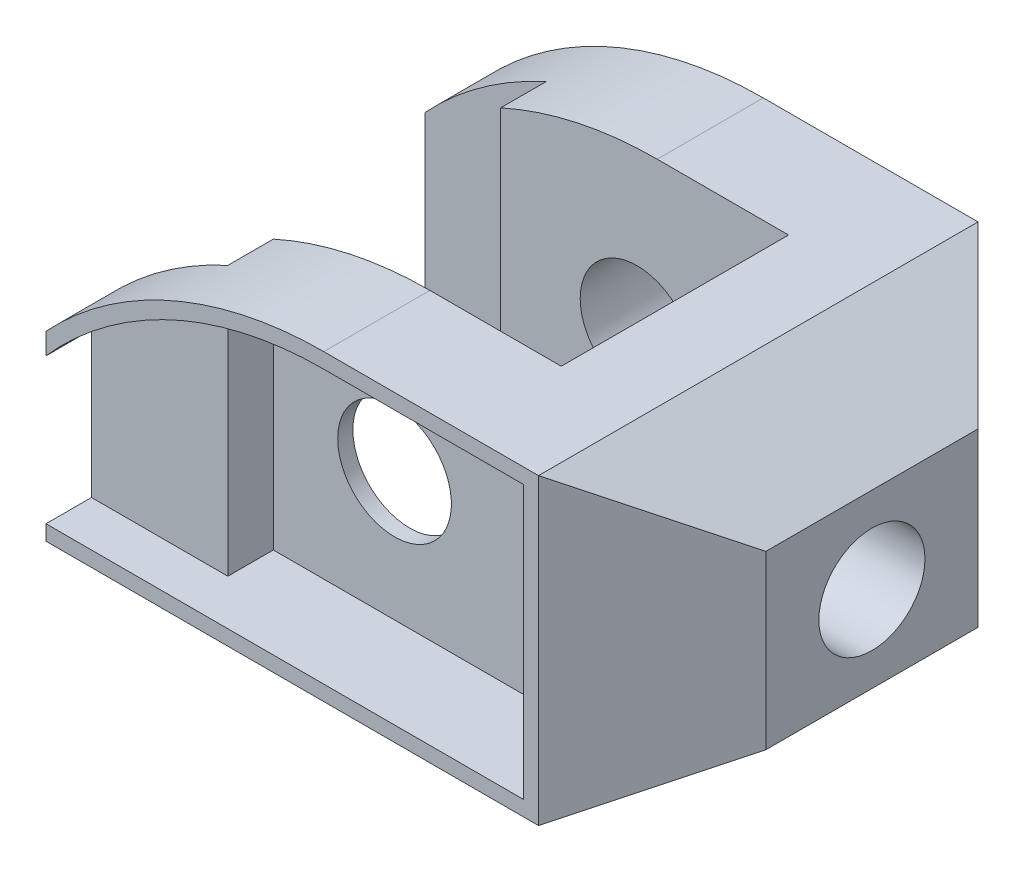
from build123d import *

# Parameters (mm, degrees)
SKETCH1_R               = 7.5
BOSS_EXTRUDE1_DEPTH     = 58
CUT_EXTRUDE1_DEPTH      = 90.381206078
CUT_EXTRUDE1_DEPTH_BACK = 90.381206078
CUT_EXTRUDE2_DEPTH      = 96.859271852
CUT_EXTRUDE2_DEPTH_BACK = 96.859271852
CUT_EXTRUDE3_DEPTH      = 107.60206377
CUT_EXTRUDE3_DEPTH_BACK = 107.60206377
SKETCH7_R               = 7
CUT_EXTRUDE6_DEPTH      = 12
CUT_EXTRUDE7_DEPTH      = 6


with BuildPart() as part:
    # Sketch1 → Boss-Extrude1 (new body)
    with BuildSketch(Plane.XY):
        with BuildLine():
            Line((0, 0), (-65, 0))
            Line((-65, 0), (-65, 24))
            ThreePointArc((-65, 24), (-48.33939444, 35.82575695), (-28.33939444, 40))
            Line((-28.33939444, 40), (0, 40))
            Line((0, 40), (15, 31.339745962))
            Line((15, 31.339745962), (15, 8.660254038))
            Line((15, 8.660254038), (0, 0))
        make_face()
        with Locations(Location((-31, 19, 0), (0, 0, 180))):
            Circle(SKETCH1_R, mode=Mode.SUBTRACT)
    extrude(amount=BOSS_EXTRUDE1_DEPTH)

    # Sketch3 → Cut-Extrude1 (cut, two sides: drawn at the far end of the back side and taken through both)
    with BuildSketch(Plane(origin=(0, 20, 0), x_dir=(1, 0, 0), z_dir=(0, 1, 0)).offset(-CUT_EXTRUDE1_DEPTH_BACK)):
        Polygon((-11, -44), (-11, -14), (-49, -14), (-49, -8), (-65, -8), (-65, -50), (-49, -50), (-49, -44), align=None)
    extrude(amount=CUT_EXTRUDE1_DEPTH + CUT_EXTRUDE1_DEPTH_BACK, mode=Mode.SUBTRACT)

    # Sketch6 → Cut-Extrude2 (cut, two sides: drawn at the far end of the back side and taken through both)
    with BuildSketch(Plane(origin=(0, 0, 0), x_dir=(1, 0, 0), z_dir=(0, 1, 0)).offset(-CUT_EXTRUDE2_DEPTH_BACK)):
        Polygon((0, 0), (15, -15), (15, 0), align=None)
        Polygon((15, -58), (15, -43), (0, -58), align=None)
    extrude(amount=CUT_EXTRUDE2_DEPTH + CUT_EXTRUDE2_DEPTH_BACK, mode=Mode.SUBTRACT)

    # Sketch7 → Cut-Extrude3 (cut, two sides: drawn at the far end of the back side and taken through both)
    with BuildSketch(Plane(origin=(15, 0, 0), x_dir=(0, 0, -1), z_dir=(1, 0, 0)).offset(-CUT_EXTRUDE3_DEPTH_BACK)):
        with Locations(Location((-29, 20, 0), (0, 0, 90))):
            Circle(SKETCH7_R)
    extrude(amount=CUT_EXTRUDE3_DEPTH + CUT_EXTRUDE3_DEPTH_BACK, mode=Mode.SUBTRACT)

    # Sketch8 → Cut-Extrude6 (cut)
    with BuildSketch(Plane.XY.offset(58)):
        with BuildLine():
            Line((-47, 34.224221872), (-47, 2))
            Line((-47, 2), (-2, 2))
            Line((-2, 2), (-2, 38))
            Line((-2, 38), (-28.33939444, 38))
            ThreePointArc((-28.33939444, 38), (-37.858778616, 37.046586751), (-47, 34.224221872))
        make_face()
    extrude(amount=-CUT_EXTRUDE6_DEPTH, mode=Mode.SUBTRACT)

    # Sketch16 → Cut-Extrude7 (cut)
    with BuildSketch(Plane.XY.offset(58)):
        with BuildLine():
            Line((-65, 21.1865019), (-65, 2))
            Line((-65, 2), (-47, 2))
            Line((-47, 2), (-47, 34.224221872))
            ThreePointArc((-47, 34.224221872), (-56.733711161, 28.718330483), (-65, 21.1865019))
        make_face()
    extrude(amount=-CUT_EXTRUDE7_DEPTH, mode=Mode.SUBTRACT)


solid = part.part
